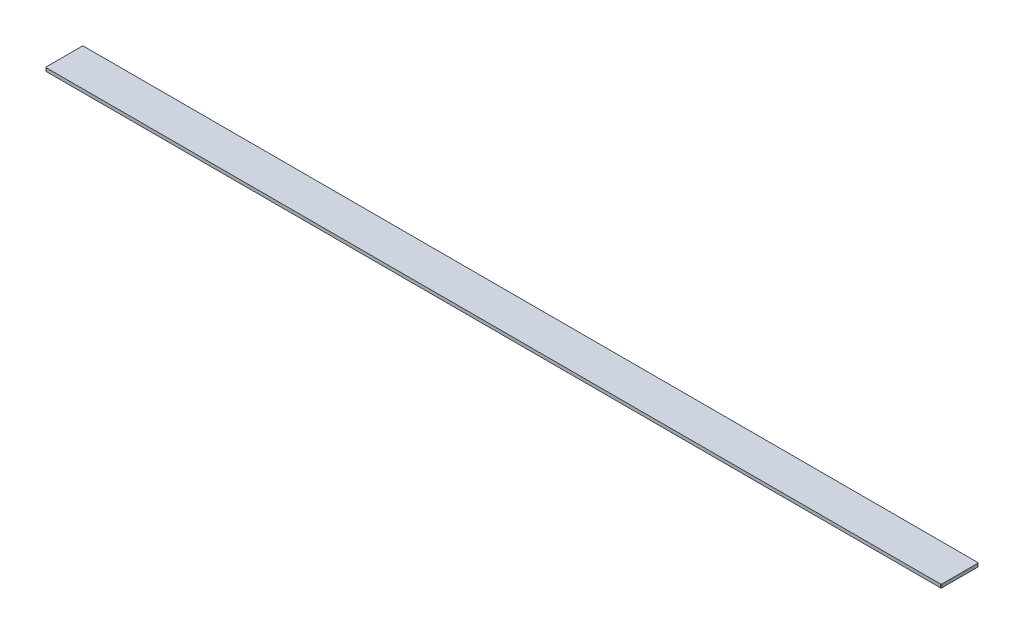
from build123d import *

# Parameters (mm, degrees)
SKETCH1_W           = 540
SKETCH1_H           = 22.5
BOSS_EXTRUDE1_DEPTH = 2
FILLET1_R           = 0.5


with BuildPart() as part:
    # Sketch1 → Boss-Extrude1 (new body)
    with BuildSketch(Plane(origin=(0, 0, 0), x_dir=(1, 0, 0), z_dir=(0, 1, 0))):
        Rectangle(SKETCH1_W, SKETCH1_H)
    extrude(amount=BOSS_EXTRUDE1_DEPTH)

    # Fillet1
    fillet1_edges = [part.edges().sort_by_distance(p)[0] for p in [
        (-270, 1, -11.25),
        (270, 1, -11.25),
        (270, 1, 11.25),
        (-270, 1, 11.25),
    ]]
    fillet(fillet1_edges, radius=FILLET1_R)


solid = part.part
